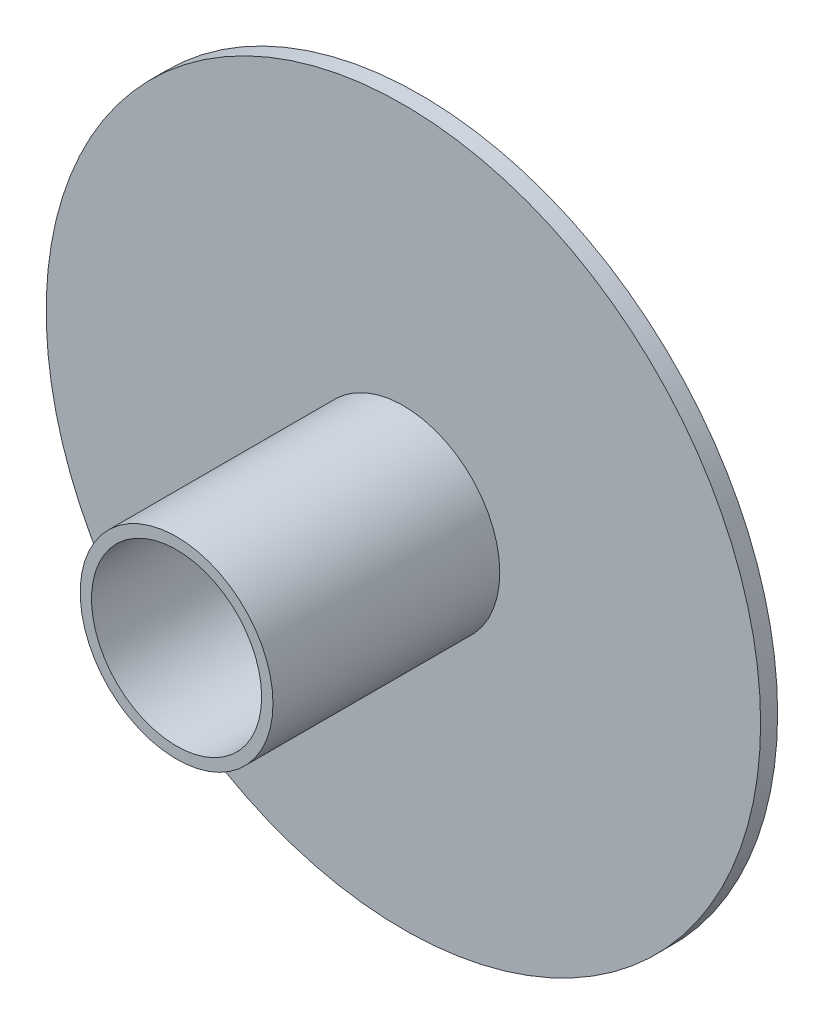
from build123d import *

# Parameters (mm, degrees)
SKETCH1_R               = 31.5
BOSS_EXTRUDE1_DEPTH     = 1.5
SKETCH2_R               = 8.5
BOSS_EXTRUDE2_DEPTH     = 20
CUT_EXTRUDE1_DEPTH      = 50.464633831
CUT_EXTRUDE1_DEPTH_BACK = 50.464633831
SKETCH3_R               = 7.5


with BuildPart() as part:
    # Sketch1 → Boss-Extrude1 (new body)
    with BuildSketch(Plane.XY):
        Circle(SKETCH1_R)
    extrude(amount=BOSS_EXTRUDE1_DEPTH)

    # Sketch2 → Boss-Extrude2 (add)
    with BuildSketch(Plane.XY.offset(1.5)):
        Circle(SKETCH2_R)
    extrude(amount=BOSS_EXTRUDE2_DEPTH)

    # Sketch3 → Cut-Extrude1 (cut, two sides: drawn at the far end of the back side and taken through both)
    with BuildSketch(Plane.XY.offset(21.5).offset(-CUT_EXTRUDE1_DEPTH_BACK)):
        Circle(SKETCH3_R)
    extrude(amount=CUT_EXTRUDE1_DEPTH + CUT_EXTRUDE1_DEPTH_BACK, mode=Mode.SUBTRACT)


solid = part.part
